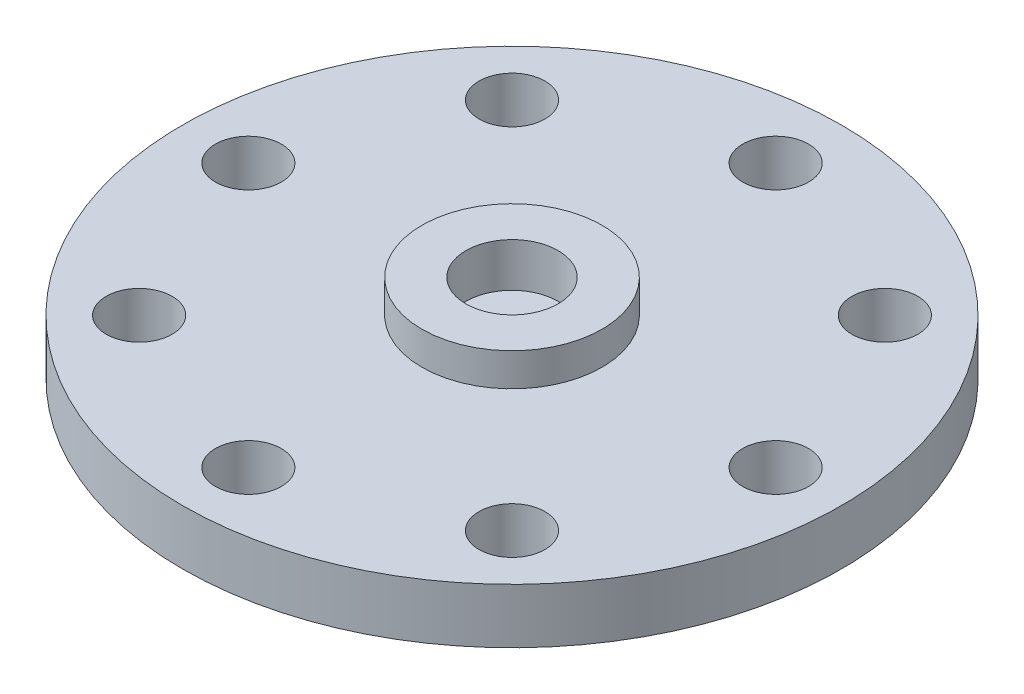
from build123d import *

# Parameters (mm, degrees)
SKETCH1_R           = 15
SKETCH1_R_2         = 1.5
BOSS_EXTRUDE1_DEPTH = 4
SKETCH2_R           = 2.1
CUT_EXTRUDE1_DEPTH  = 2
SKETCH3_R           = 21.629030548
SKETCH3_R_2         = 4.1
CUT_EXTRUDE2_DEPTH  = 1.5


with BuildPart() as part:
    # Sketch1 → Boss-Extrude1 (new body)
    with BuildSketch(Plane(origin=(0, 0, 0), x_dir=(1, 0, 0), z_dir=(0, 1, 0))):
        with Locations(Location((-8.445672376, 3.816794247, 0), (0, 0, 270))):
            Circle(SKETCH1_R)
        with Locations(Location((-8.445672376, 15.816794247, 0), (0, 0, 270))):
            Circle(SKETCH1_R_2, mode=Mode.SUBTRACT)
        with Locations(Location((0.039608998, 12.302075621, 0), (0, 0, 270))):
            Circle(SKETCH1_R_2, mode=Mode.SUBTRACT)
        with Locations(Location((3.554327624, 3.816794247, 0), (0, 0, 270))):
            Circle(SKETCH1_R_2, mode=Mode.SUBTRACT)
        with Locations(Location((0.039608998, -4.668487127, 0), (0, 0, 270))):
            Circle(SKETCH1_R_2, mode=Mode.SUBTRACT)
        with Locations(Location((-8.445672376, -8.183205753, 0), (0, 0, 270))):
            Circle(SKETCH1_R_2, mode=Mode.SUBTRACT)
        with Locations(Location((-16.93095375, -4.668487127, 0), (0, 0, 270))):
            Circle(SKETCH1_R_2, mode=Mode.SUBTRACT)
        with Locations(Location((-20.445672376, 3.816794247, 0), (0, 0, 270))):
            Circle(SKETCH1_R_2, mode=Mode.SUBTRACT)
        with Locations(Location((-16.93095375, 12.302075621, 0), (0, 0, 270))):
            Circle(SKETCH1_R_2, mode=Mode.SUBTRACT)
    extrude(amount=BOSS_EXTRUDE1_DEPTH)

    # Sketch2 → Cut-Extrude1 (cut)
    with BuildSketch(Plane(origin=(0, 4, 0), x_dir=(1, 0, 0), z_dir=(0, 1, 0))):
        with Locations(Location((-8.445672376, 3.816794247, 0), (0, 0, 270))):
            Circle(SKETCH2_R)
    extrude(amount=-CUT_EXTRUDE1_DEPTH, mode=Mode.SUBTRACT)

    # Sketch3 → Cut-Extrude2 (cut)
    with BuildSketch(Plane(origin=(0, 4, 0), x_dir=(1, 0, 0), z_dir=(0, 1, 0))):
        with Locations((-8.445672376, 3.816794247)):
            Circle(SKETCH3_R)
        with Locations(Location((-8.445672376, 3.816794247, 0), (0, 0, 270))):
            Circle(SKETCH3_R_2, mode=Mode.SUBTRACT)
    extrude(amount=-CUT_EXTRUDE2_DEPTH, mode=Mode.SUBTRACT)


solid = part.part
